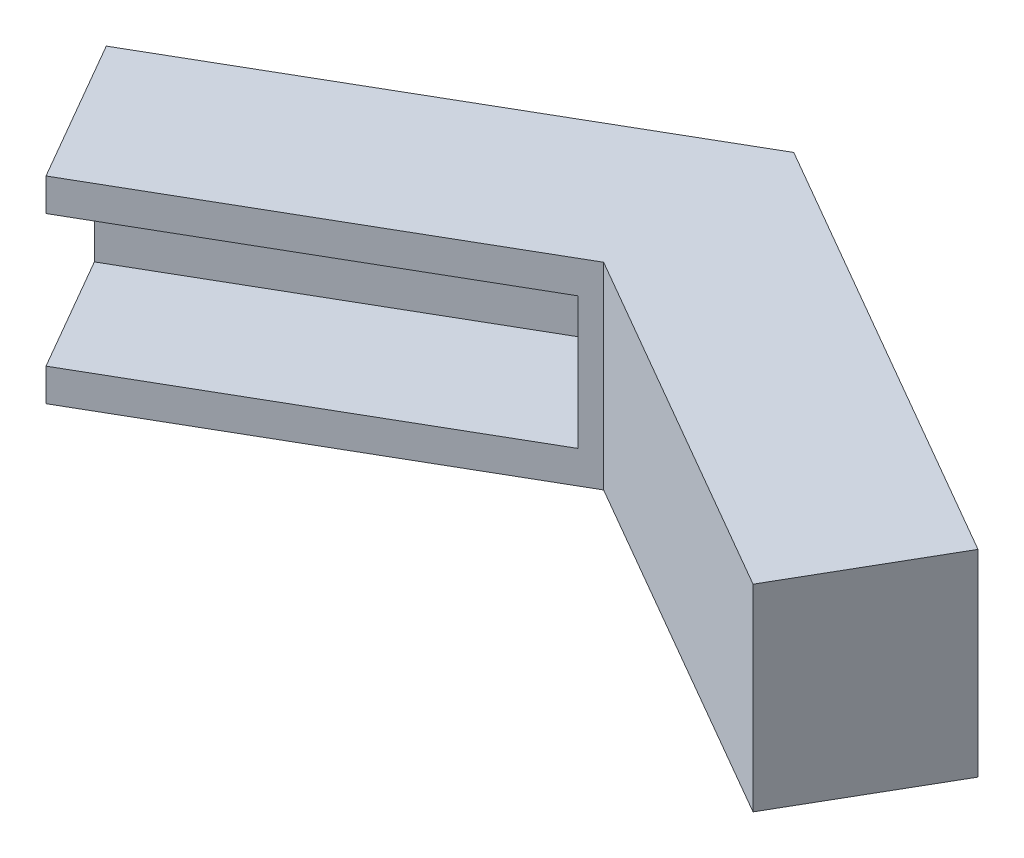
from build123d import *

# Parameters (mm, degrees)
BOSS_EXTRUDE3_DEPTH = 30.3
SKETCH8_W           = 59.828625185
SKETCH8_H           = 20.3
CUT_EXTRUDE5_DEPTH  = 20.3


with BuildPart() as part:
    # Sketch7 → Boss-Extrude3 (new body)
    with BuildSketch(Plane(origin=(0, 0, 0), x_dir=(1, 0, 0), z_dir=(0, 1, 0))):
        Polygon((-66.963109284, -4.016492488), (-54.313109284, -25.926935204), (0, 5.430753062), (54.313109284, -25.926935204), (66.963109284, -4.016492488), (0, 34.644676683), align=None)
    extrude(amount=BOSS_EXTRUDE3_DEPTH)

    # Sketch8 → Cut-Extrude5 (cut)
    with BuildSketch(Plane(origin=(-2.351585057, 0, -4.073064796), x_dir=(0.8660254037844386, 0, -0.5000000000000003), z_dir=(0.5000000000000002, 0, 0.8660254037844385))):
        with Locations((-30.085687408, 15.15)):
            Rectangle(SKETCH8_W, SKETCH8_H)
    extrude(amount=-CUT_EXTRUDE5_DEPTH, mode=Mode.SUBTRACT)


solid = part.part
